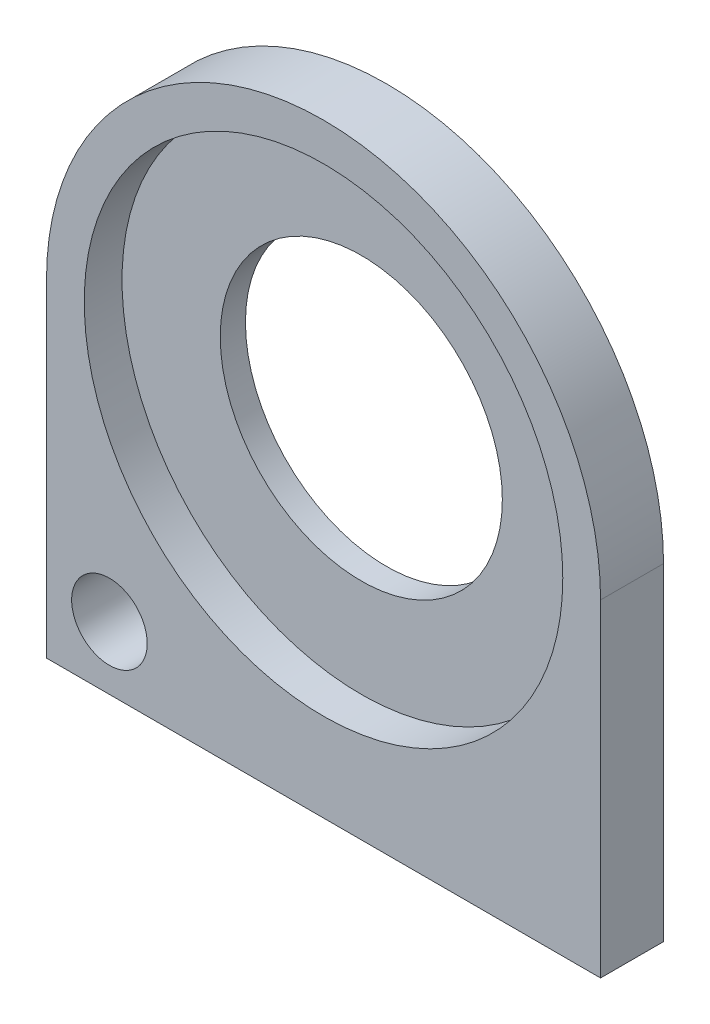
from build123d import *

# Parameters (mm, degrees)
ESQUISSE1_R      = 5.6
EXTRUSION1_DEPTH = 2.5
ESQUISSE2_R      = 9.5
EXTRUSION2_DEPTH = 1.5
ESQUISSE3_R      = 1.5
EXTRUSION3_DEPTH = 31.141796481


with BuildPart() as part:
    # Esquisse1 → Extrusion1 (new body)
    with BuildSketch(Plane.XY):
        with BuildLine():
            Line((-22, 9.451843318), (-22, -3.548156682))
            Line((-22, -3.548156682), (0, -3.548156682))
            Line((0, -3.548156682), (0, 9.451843318))
            ThreePointArc((0, 9.451843318), (-11, 20.451843318), (-22, 9.451843318))
        make_face()
        with Locations((-11, 9.451843318)):
            Circle(ESQUISSE1_R, mode=Mode.SUBTRACT)
    extrude(amount=EXTRUSION1_DEPTH)

    # Esquisse2 → Extrusion2 (cut)
    with BuildSketch(Plane.XY.offset(2.5)):
        with Locations((-11, 9.451843318)):
            Circle(ESQUISSE2_R)
    extrude(amount=-EXTRUSION2_DEPTH, mode=Mode.SUBTRACT)

    # Esquisse3 → Extrusion3 (cut, through all)
    with BuildSketch(Plane.XY.offset(2.5)):
        with Locations((-19.5, -1.048156682)):
            Circle(ESQUISSE3_R)
    extrude(amount=-EXTRUSION3_DEPTH, mode=Mode.SUBTRACT)


solid = part.part
